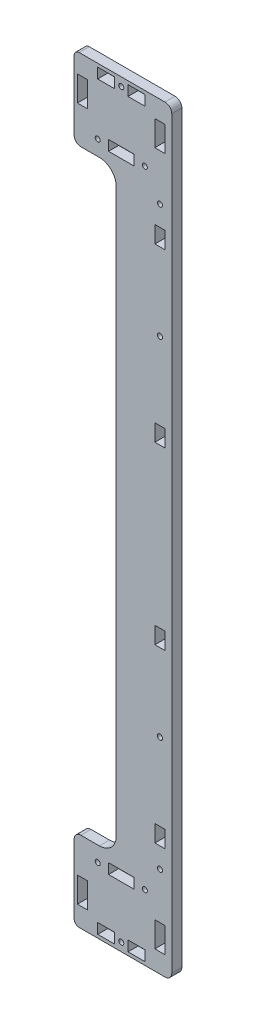
from build123d import *

# Parameters (mm, degrees)
SKETCH_1_R      = 1.5
SKETCH_1_R_2    = 1.55
SKETCH_1_W      = 10
SKETCH_1_H      = 6.1
SKETCH_1_W_2    = 15.1
SKETCH_1_W_3    = 6.1
SKETCH_1_H_2    = 15
SKETCH_1_W_4    = 6
SKETCH_1_H_3    = 10
EXTRUDE_1_DEPTH = 6


with BuildPart() as part:
    # Эскиз1 → Бобышка-Вытянуть1 (new body)
    with BuildSketch(Plane.XY):
        with BuildLine():
            Line((-29, 222.1), (-29, 181.1))
            ThreePointArc((-29, 181.1), (-27.828427125, 178.271572875), (-25, 177.1))
            Line((-25, 177.1), (-14, 177.1))
            ThreePointArc((-14, 177.1), (-6.928932188, 174.171067812), (-4, 167.1))
            Line((-4, 167.1), (-4, -167.1))
            ThreePointArc((-4, -167.1), (-6.928932188, -174.171067812), (-14, -177.1))
            Line((-14, -177.1), (-25, -177.1))
            ThreePointArc((-25, -177.1), (-27.828427125, -178.271572875), (-29, -181.1))
            Line((-29, -181.1), (-29, -222.1))
            ThreePointArc((-29, -222.1), (-28.121320344, -224.221320344), (-26, -225.1))
            Line((-26, -225.1), (25, -225.1))
            ThreePointArc((25, -225.1), (27.828427125, -223.928427125), (29, -221.1))
            Line((29, -221.1), (29, 221.1))
            ThreePointArc((29, 221.1), (27.828427125, 223.928427125), (25, 225.1))
            Line((25, 225.1), (-26, 225.1))
            ThreePointArc((-26, 225.1), (-28.121320344, 224.221320344), (-29, 222.1))
        make_face()
        with Locations((22, 171.1)):
            Circle(SKETCH_1_R, mode=Mode.SUBTRACT)
        with Locations((13, 186.1)):
            Circle(SKETCH_1_R, mode=Mode.SUBTRACT)
        with Locations((-1, 220.1)):
            Circle(SKETCH_1_R, mode=Mode.SUBTRACT)
        with Locations((-15, 186.1)):
            Circle(SKETCH_1_R, mode=Mode.SUBTRACT)
        with Locations((22, 103.1)):
            Circle(SKETCH_1_R_2, mode=Mode.SUBTRACT)
        with Locations((22, -171.1)):
            Circle(SKETCH_1_R, mode=Mode.SUBTRACT)
        with Locations((13, -186.1)):
            Circle(SKETCH_1_R, mode=Mode.SUBTRACT)
        with Locations((-1, -220.1)):
            Circle(SKETCH_1_R, mode=Mode.SUBTRACT)
        with Locations((-15, -186.1)):
            Circle(SKETCH_1_R, mode=Mode.SUBTRACT)
        with Locations((22, -103.1)):
            Circle(SKETCH_1_R_2, mode=Mode.SUBTRACT)
        with Locations((-10, 220.05)):
            Rectangle(SKETCH_1_W, SKETCH_1_H, mode=Mode.SUBTRACT)
        with Locations((-1, 186.05)):
            Rectangle(SKETCH_1_W_2, SKETCH_1_H, mode=Mode.SUBTRACT)
        with Locations((8, 220.05)):
            Rectangle(SKETCH_1_W, SKETCH_1_H, mode=Mode.SUBTRACT)
        with Locations((-24, 206.1)):
            Rectangle(SKETCH_1_W_3, SKETCH_1_H_2, mode=Mode.SUBTRACT)
        with Locations((22, 206.1)):
            Rectangle(SKETCH_1_W_3, SKETCH_1_H_2, mode=Mode.SUBTRACT)
        with Locations((22, 52.1)):
            Rectangle(SKETCH_1_W_4, SKETCH_1_H_3, mode=Mode.SUBTRACT)
        with Locations((22, 154.1)):
            Rectangle(SKETCH_1_W_4, SKETCH_1_H_3, mode=Mode.SUBTRACT)
        with Locations((-10, -220.05)):
            Rectangle(SKETCH_1_W, SKETCH_1_H, mode=Mode.SUBTRACT)
        with Locations((-1, -186.05)):
            Rectangle(SKETCH_1_W_2, SKETCH_1_H, mode=Mode.SUBTRACT)
        with Locations((8, -220.05)):
            Rectangle(SKETCH_1_W, SKETCH_1_H, mode=Mode.SUBTRACT)
        with Locations((-24, -206.1)):
            Rectangle(SKETCH_1_W_3, SKETCH_1_H_2, mode=Mode.SUBTRACT)
        with Locations((22, -206.1)):
            Rectangle(SKETCH_1_W_3, SKETCH_1_H_2, mode=Mode.SUBTRACT)
        with Locations((22, -52.1)):
            Rectangle(SKETCH_1_W_4, SKETCH_1_H_3, mode=Mode.SUBTRACT)
        with Locations((22, -154.1)):
            Rectangle(SKETCH_1_W_4, SKETCH_1_H_3, mode=Mode.SUBTRACT)
    extrude(amount=EXTRUDE_1_DEPTH)


solid = part.part
